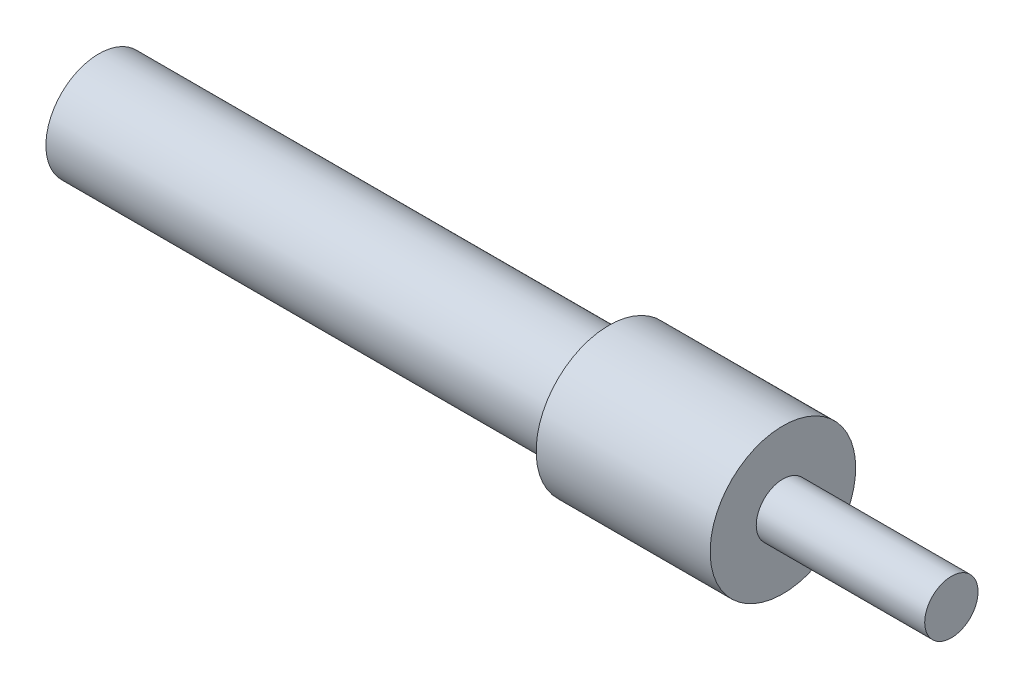
from build123d import *

# Parameters (mm, degrees)
SKETCH1_R           = 6.48
BOSS_EXTRUDE1_DEPTH = 15.494
SKETCH2_R           = 4.715
BOSS_EXTRUDE2_DEPTH = 60.91
SKETCH3_R           = 2.375
BOSS_EXTRUDE3_DEPTH = 15


with BuildPart() as part:
    # Sketch1 → Boss-Extrude1 (new body)
    with BuildSketch(Plane.YZ):
        with Locations(Location((0, 0, 0), (0, 0, 270))):
            Circle(SKETCH1_R)
    extrude(amount=BOSS_EXTRUDE1_DEPTH)

    # Sketch2 → Boss-Extrude2 (add)
    with BuildSketch(Plane.YZ.offset(15.494)):
        with Locations(Location((0, 0, 0), (0, 0, 270))):
            Circle(SKETCH2_R)
    extrude(amount=-BOSS_EXTRUDE2_DEPTH)

    # Sketch3 → Boss-Extrude3 (add)
    with BuildSketch(Plane(origin=(15.494, 0, 0), x_dir=(0, -1, 0), z_dir=(-1, 0, 0))):
        with Locations(Location((0, 0, 0), (0, 0, 90))):
            Circle(SKETCH3_R)
    extrude(amount=-BOSS_EXTRUDE3_DEPTH)


solid = part.part
